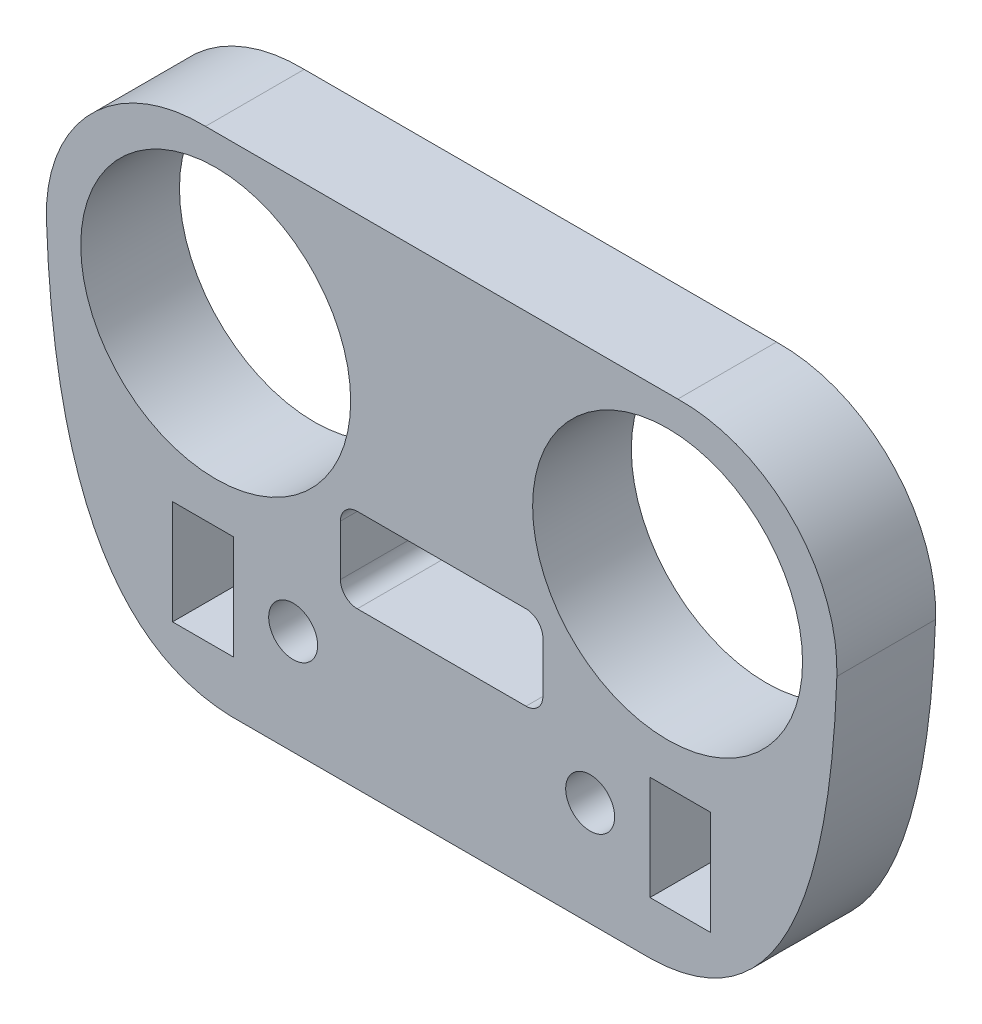
from build123d import *

# Parameters (mm, degrees)
MODEL_R             = 1.449812935
MODEL_R_2           = 7.999917631
MODEL_W             = 3.6
MODEL_H             = 6.173462
BOSS_EXTRUDE1_DEPTH = 5.85


with BuildPart() as part:
    # Model → Boss-Extrude1 (new body)
    with BuildSketch(Plane.XY):
        with BuildLine():
            ThreePointArc((531.251426748, 585.073190054), (533.909979714, 591.869304693), (540.677443159, 594.599966993))
            Line((540.677443159, 594.599966993), (568.674763139, 594.599966993))
            ThreePointArc((568.674763139, 594.599966993), (575.442226583, 591.869304693), (578.10077955, 585.073190054))
            add(Edge.make_bspline(
                [(578.10077955, 585.073190054), (577.425296665, 565.393042288), (567.160030567, 565.073190054)],
                knots=[0, 0, 0, 1, 1, 1], degree=2))
            Line((567.160030567, 565.073190054), (542.192175731, 565.073190054))
            add(Edge.make_bspline(
                [(531.251426748, 585.073190054), (531.926909632, 565.393042288), (542.192175731, 565.073190054)],
                knots=[0, 0, 0, 1, 1, 1], degree=2))
        make_face()
        with Locations((563.478415084, 571.273190054)):
            Circle(MODEL_R, mode=Mode.SUBTRACT)
        with Locations((541.283961295, 584.797511369)):
            Circle(MODEL_R_2, mode=Mode.SUBTRACT)
        with Locations((545.873791214, 571.273190054)):
            Circle(MODEL_R, mode=Mode.SUBTRACT)
        with Locations((568.068245003, 584.797511369)):
            Circle(MODEL_R_2, mode=Mode.SUBTRACT)
        with BuildLine():
            Line((560.676103149, 578.334674665), (560.676103149, 575.334674665))
            ThreePointArc((560.676103149, 575.334674665), (560.38320993, 574.627567884), (559.676103149, 574.334674665))
            Line((559.676103149, 574.334674665), (554.676103149, 574.334674665))
            Line((554.676103149, 574.334674665), (549.676103149, 574.334674665))
            ThreePointArc((549.676103149, 574.334674665), (548.968996368, 574.627567884), (548.676103149, 575.334674665))
            Line((548.676103149, 575.334674665), (548.676103149, 578.334674665))
            ThreePointArc((548.676103149, 578.334674665), (548.968996368, 579.041781446), (549.676103149, 579.334674665))
            Line((549.676103149, 579.334674665), (554.676103149, 579.334674665))
            Line((554.676103149, 579.334674665), (559.676103149, 579.334674665))
            ThreePointArc((559.676103149, 579.334674665), (560.38320993, 579.041781446), (560.676103149, 578.334674665))
        make_face(mode=Mode.SUBTRACT)
        with Locations((568.826370712, 571.273190054)):
            Rectangle(MODEL_W, MODEL_H, mode=Mode.SUBTRACT)
        with Locations((540.525835586, 571.273190054)):
            Rectangle(MODEL_W, MODEL_H, mode=Mode.SUBTRACT)
    extrude(amount=BOSS_EXTRUDE1_DEPTH)


solid = part.part
